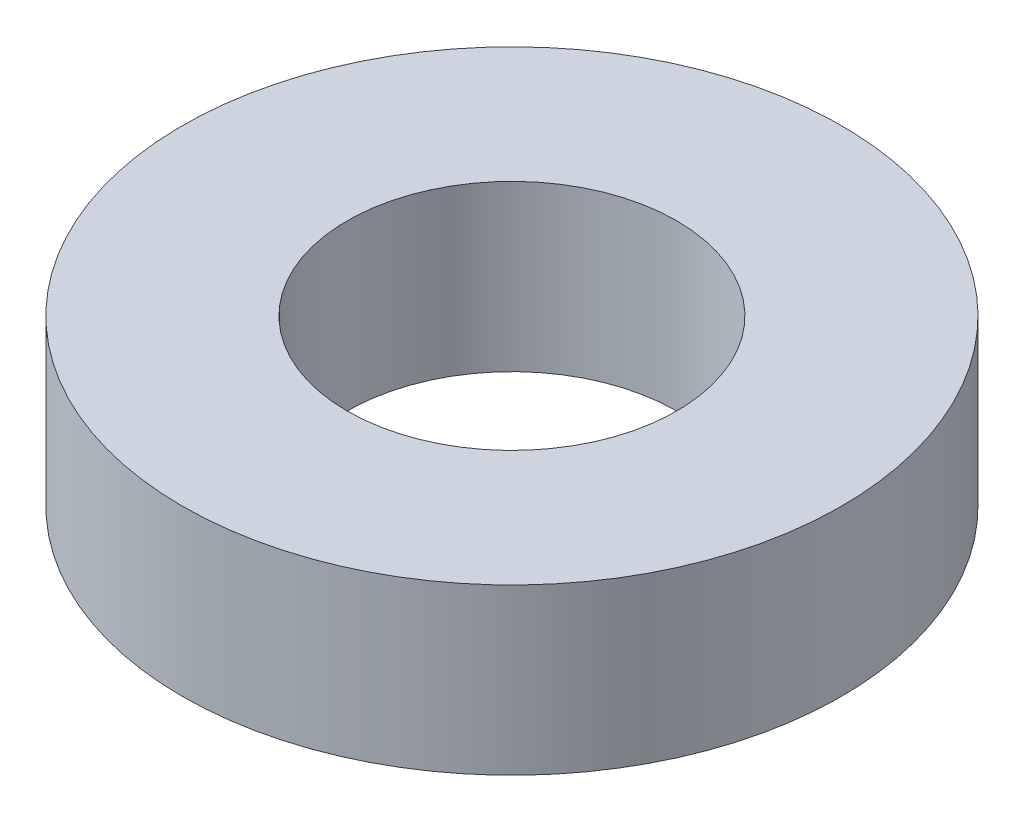
from build123d import *

# Parameters (mm, degrees)
SKETCH1_R           = 6
BOSS_EXTRUDE1_DEPTH = 3
SKETCH2_R           = 3
CUT_EXTRUDE1_DEPTH  = 10


with BuildPart() as part:
    # Sketch1 → Boss-Extrude1 (new body)
    with BuildSketch(Plane(origin=(0, 0, 0), x_dir=(1, 0, 0), z_dir=(0, 1, 0))):
        with Locations(Location((0, 0, 0), (0, 0, 270))):
            Circle(SKETCH1_R)
    extrude(amount=BOSS_EXTRUDE1_DEPTH)

    # Sketch2 → Cut-Extrude1 (cut, through all)
    with BuildSketch(Plane(origin=(0, 3, 0), x_dir=(1, 0, 0), z_dir=(0, 1, 0))):
        with Locations(Location((0, 0, 0), (0, 0, 270))):
            Circle(SKETCH2_R)
    extrude(amount=-CUT_EXTRUDE1_DEPTH, mode=Mode.SUBTRACT)


solid = part.part
